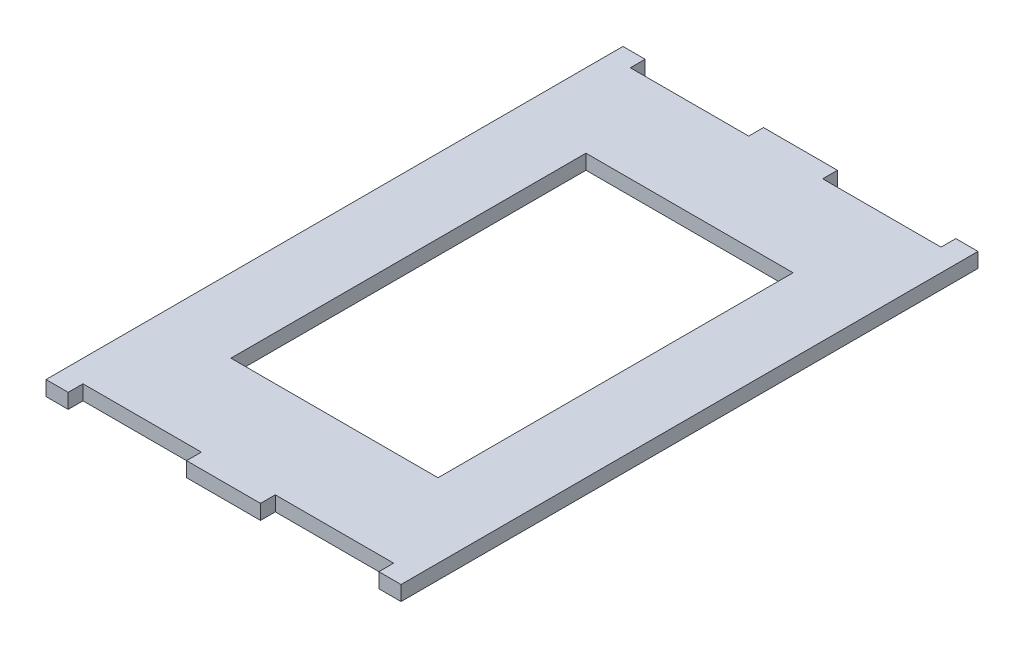
from build123d import *

# Parameters (mm, degrees)
ESQUISSE1_W        = 140
ESQUISSE1_H        = 240
BOSS_EXTRU_1_DEPTH = 10


with BuildPart() as part:
    # Esquisse1 → Boss.-Extru.1 (new body)
    with BuildSketch(Plane(origin=(0, 0, 0), x_dir=(1, 0, 0), z_dir=(0, 1, 0))):
        Polygon((15, 10), (15, 0), (0, 0), (0, 10), (0, 380), (0, 390), (15, 390), (15, 380), (95, 380), (95, 390), (145, 390), (145, 380), (225, 380), (225, 390), (240, 390), (240, 380), (240, 10), (240, 0), (225, 0), (225, 10), (145, 10), (145, 0), (95, 0), (95, 10), align=None)
        with Locations((120, 195)):
            Rectangle(ESQUISSE1_W, ESQUISSE1_H, mode=Mode.SUBTRACT)
    extrude(amount=BOSS_EXTRU_1_DEPTH)


solid = part.part
